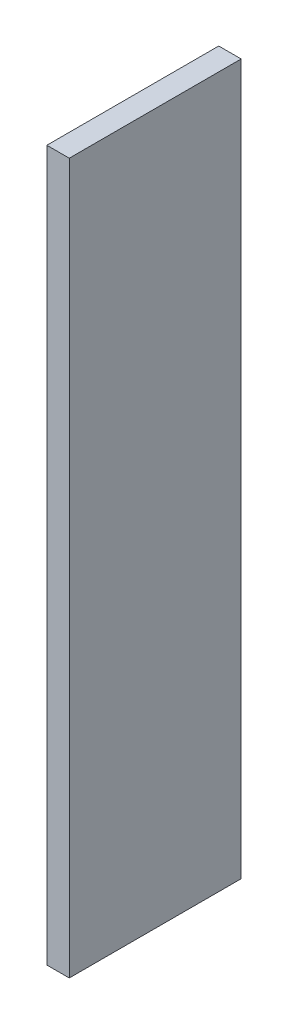
from build123d import *

# Parameters (mm, degrees)
SKETCH1_W           = 152.4
SKETCH1_H           = 1168.4
BOSS_EXTRUDE1_DEPTH = 4826


with BuildPart() as part:
    # Sketch1 → Boss-Extrude1 (new body)
    with BuildSketch(Plane(origin=(0, 0, 0), x_dir=(1, 0, 0), z_dir=(0, 1, 0))):
        Rectangle(SKETCH1_W, SKETCH1_H)
    extrude(amount=BOSS_EXTRUDE1_DEPTH)


solid = part.part
